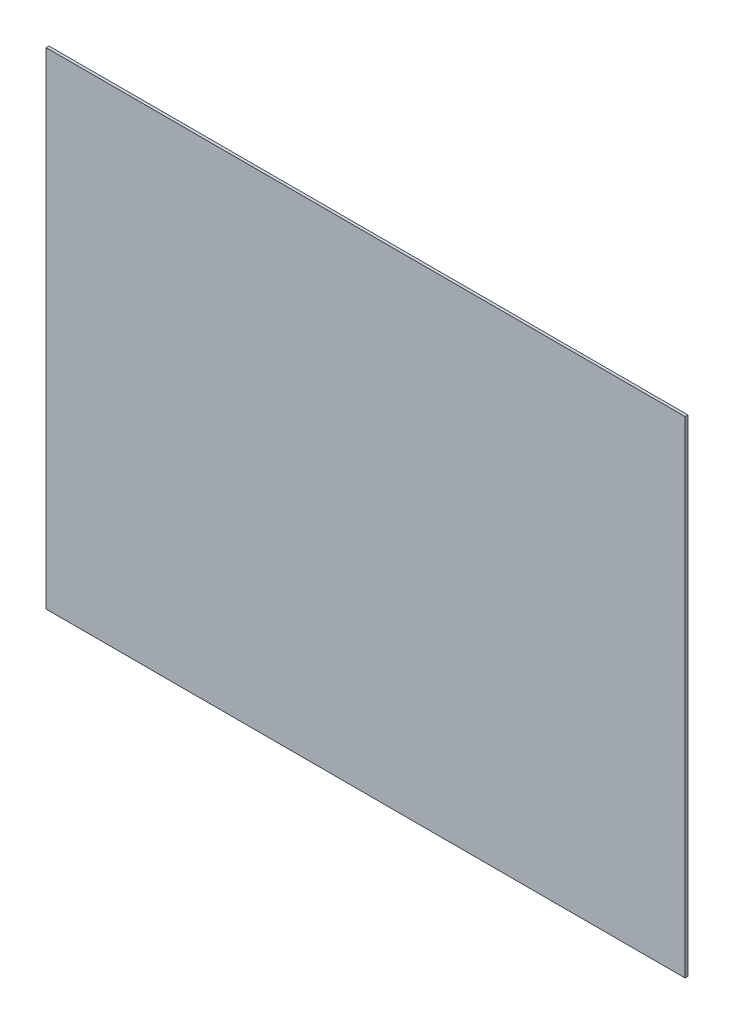
from build123d import *

# Parameters (mm, degrees)
SKETCH1_W           = 113
SKETCH1_H           = 86
BOSS_EXTRUDE1_DEPTH = 0.5


with BuildPart() as part:
    # Sketch1 → Boss-Extrude1 (new body)
    with BuildSketch(Plane.XY):
        Rectangle(SKETCH1_W, SKETCH1_H)
    extrude(amount=BOSS_EXTRUDE1_DEPTH)


solid = part.part
